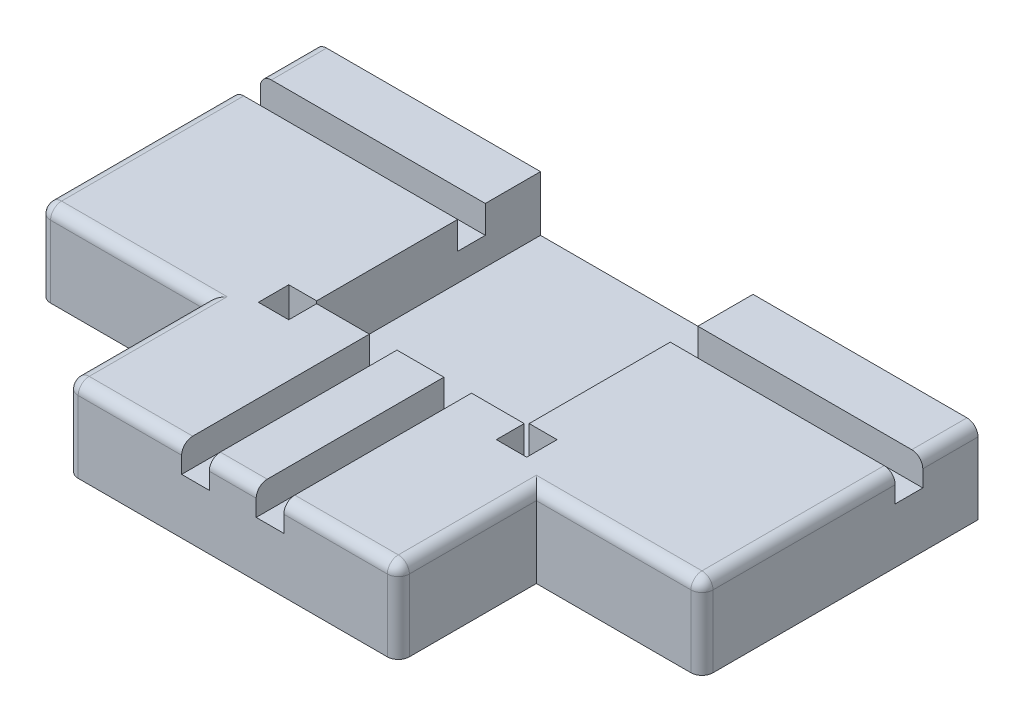
from build123d import *

# Parameters (mm, degrees)
SKETCH1_W                                  = 120
SKETCH1_H                                  = 100
BOSS_EXTRUDE1_DEPTH                        = 15
SKETCH7_W                                  = 60
SKETCH7_H                                  = 25
BOSS_EXTRUDE6_DEPTH                        = 15
FILLET1_R                                  = 2
SKETCH2_W                                  = 38.5
SKETCH2_H                                  = 82
CUT_EXTRUDE1_DEPTH                         = 10
CUT_EXTRUDE3_DEPTH                         = 5
SKETCH11_W                                 = 5.5
SKETCH11_H                                 = 5.5
CUT_EXTRUDE6_DEPTH                         = 7
MIRROR3_AT_THE_SECOND_PLANE_COPY_1_SKETC_W = 5.5
MIRROR3_AT_THE_SECOND_PLANE_COPY_1_SKETC_H = 5.5
MIRROR3_AT_THE_SECOND_PLANE_COPY_1_DEPTH   = 7
MIRROR4_AT_THE_SECOND_PLANE_COPY_1_DEPTH   = 5
CUT_EXTRUDE7_REACH                         = 99.211
SKETCH12_W                                 = 131.778064034
SKETCH12_H                                 = 21.740712993


with BuildPart() as part:
    # Sketch1 → Boss-Extrude1 (new body)
    with BuildSketch(Plane(origin=(0, 0, 0), x_dir=(1, 0, 0), z_dir=(0, 1, 0))):
        Rectangle(SKETCH1_W, SKETCH1_H)
    extrude(amount=BOSS_EXTRUDE1_DEPTH)

    # Sketch7 → Boss-Extrude6 (add)
    with BuildSketch(Plane(origin=(0, 0, 0), x_dir=(1, 0, 0), z_dir=(0, 1, 0))):
        with Locations((0, -62.5)):
            Rectangle(SKETCH7_W, SKETCH7_H)
        with Locations((0, 62.5)):
            Rectangle(SKETCH7_W, SKETCH7_H)
    extrude(amount=BOSS_EXTRUDE6_DEPTH)

    # Fillet1
    fillet1_edges = [part.edges().sort_by_distance(p)[0] for p in [
        (-60, 15, 0),
        (45, 15, 50),
        (-45, 15, 50),
        (-30, 7.5, 75),
        (30, 7.5, 75),
        (-30, 15, 62.5),
        (0, 15, 75),
        (30, 15, 62.5),
        (-45, 15, -50),
        (0, 15, -75),
        (30, 7.5, -75),
        (-30, 15, -62.5),
        (-30, 7.5, -75),
        (30, 15, -62.5),
        (60, 15, 0),
        (60, 7.5, 50),
        (-60, 7.5, 50),
        (-60, 7.5, -50),
        (60, 7.5, -50),
        (45, 15, -50),
    ]]
    fillet(fillet1_edges, radius=FILLET1_R)

    # Sketch2 → Cut-Extrude1 (cut)
    with BuildSketch(Plane(origin=(0, 15, 0), x_dir=(1, 0, 0), z_dir=(0, 1, 0))):
        Rectangle(SKETCH2_W, SKETCH2_H)
    extrude(amount=-CUT_EXTRUDE1_DEPTH, mode=Mode.SUBTRACT)

    # Sketch10 → Cut-Extrude3 (cut)
    with BuildSketch(Plane(origin=(0, 15, 0), x_dir=(1, 0, 0), z_dir=(0, 1, 0))):
        Polygon((-9.25, -40.5), (-9.25, -33.162899401), (-4.25, -33.162899401), (-4.25, -40.5), (-4.25, -89.766264028), (-9.25, -89.766264028), align=None)
        Polygon((-82.808425803, 15), (-19.25, 15), (-11.555108838, 15), (-11.555108838, 10), (-19.25, 10), (-82.808425803, 10), align=None)
    cut_extrude3 = extrude(amount=-CUT_EXTRUDE3_DEPTH, mode=Mode.SUBTRACT)

    # Sketch11 → Cut-Extrude6 (cut)
    with BuildSketch(Plane(origin=(0, 15, 0), x_dir=(1, 0, 0), z_dir=(0, 1, 0))):
        with Locations((-21.549732367, 43.299732367)):
            Rectangle(SKETCH11_W, SKETCH11_H)
    cut_extrude6 = extrude(amount=-CUT_EXTRUDE6_DEPTH, mode=Mode.SUBTRACT)

    # Mirror3: Cut-Extrude6 across plane
    add(cut_extrude6.mirror(Plane(origin=(0, 0, 0), x_dir=(0, 0, 1), z_dir=(1, 0, 0))), mode=Mode.SUBTRACT)

    # Mirror3 at the second plane: Cut-Extrude6 across plane
    add(cut_extrude6.mirror(Plane.XY), mode=Mode.SUBTRACT)

    # Mirror3 at the second plane copy 1 sketc → Mirror3 at the second plane copy 1 (cut)
    with BuildSketch(Plane(origin=(0, 15, 0), x_dir=(-1, 0, 0), z_dir=(0, 1, 0))):
        with Locations((-21.549732367, 43.299732367)):
            Rectangle(MIRROR3_AT_THE_SECOND_PLANE_COPY_1_SKETC_W, MIRROR3_AT_THE_SECOND_PLANE_COPY_1_SKETC_H)
    extrude(amount=-MIRROR3_AT_THE_SECOND_PLANE_COPY_1_DEPTH, mode=Mode.SUBTRACT)

    # Mirror4: Cut-Extrude3 across plane
    add(cut_extrude3.mirror(Plane(origin=(0, 0, 0), x_dir=(0, 0, 1), z_dir=(1, 0, 0))), mode=Mode.SUBTRACT)

    # Mirror4 at the second plane: Cut-Extrude3 across plane
    add(cut_extrude3.mirror(Plane.XY), mode=Mode.SUBTRACT)

    # Mirror4 at the second plane copy 1 sketc → Mirror4 at the second plane copy 1 (cut)
    with BuildSketch(Plane(origin=(0, 15, 0), x_dir=(-1, 0, 0), z_dir=(0, 1, 0))):
        Polygon((-9.25, -40.5), (-9.25, -33.162899401), (-4.25, -33.162899401), (-4.25, -40.5), (-4.25, -89.766264028), (-9.25, -89.766264028), align=None)
        Polygon((-82.808425803, 15), (-19.25, 15), (-11.555108838, 15), (-11.555108838, 10), (-19.25, 10), (-82.808425803, 10), align=None)
    extrude(amount=-MIRROR4_AT_THE_SECOND_PLANE_COPY_1_DEPTH, mode=Mode.SUBTRACT)

    # Sketch12 → Cut-Extrude7 (cut, up to next)
    with BuildSketch(Plane.XY, mode=Mode.PRIVATE) as cut_extrude7_sk1:
        with Locations((-0.266757215, 8.03351443)):
            Rectangle(SKETCH12_W, SKETCH12_H)
    cut_extrude7_tool1 = extrude(cut_extrude7_sk1.sketch, amount=-CUT_EXTRUDE7_REACH, mode=Mode.PRIVATE) & part.part
    add(cut_extrude7_tool1.solids().sort_by_distance((-0.266757, 8.033514, 0))[0], mode=Mode.SUBTRACT)


solid = part.part
